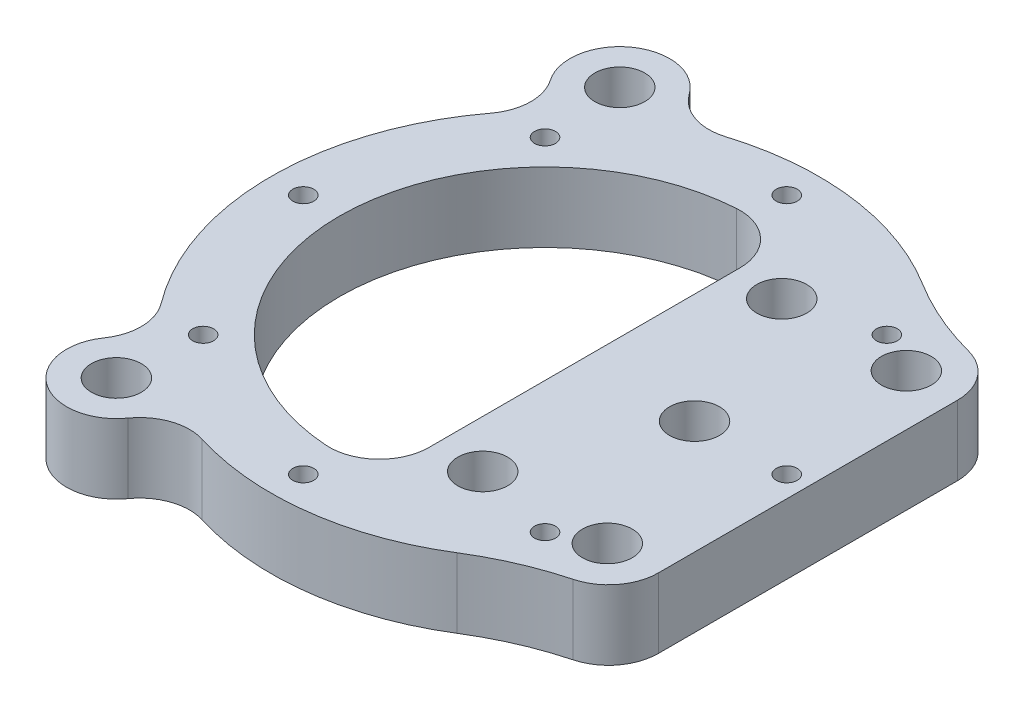
from build123d import *

# Parameters (mm, degrees)
BOSS_EXTRUDE1_DEPTH                                 = 14
FILLET1_R                                           = 10
FILLET2_R                                           = 60
SKETCH2_R                                           = 2.1
SKETCH2_R_2                                         = 3.062888277
CUT_EXTRUDE1_DEPTH                                  = 175.237067632
SKETCH3_R                                           = 2.5
CUT_EXTRUDE2_DEPTH                                  = 10
CBORE_FOR_M5_HEX_SOCKET_HEAD_CAP_SCREW1_D           = 5.5
CBORE_FOR_M5_HEX_SOCKET_HEAD_CAP_SCREW1_DEPTH       = 25
CBORE_FOR_M5_HEX_SOCKET_HEAD_CAP_SCREW1_CBORE_D     = 10
CBORE_FOR_M5_HEX_SOCKET_HEAD_CAP_SCREW1_CBORE_DEPTH = 8
CBORE_FOR_M5_HEX_SOCKET_HEAD_CAP_SCREW1_TIP         = 1.652366702
CUT_EXTRUDE3_DEPTH                                  = 25
FILLET3_R                                           = 10
CBORE_FOR_M5_HEX_SOCKET_HEAD_CAP_SCREW2_D           = 5.5
CBORE_FOR_M5_HEX_SOCKET_HEAD_CAP_SCREW2_DEPTH       = 25
CBORE_FOR_M5_HEX_SOCKET_HEAD_CAP_SCREW2_CBORE_D     = 10
CBORE_FOR_M5_HEX_SOCKET_HEAD_CAP_SCREW2_CBORE_DEPTH = 8
CBORE_FOR_M5_HEX_SOCKET_HEAD_CAP_SCREW2_TIP         = 1.652366702


with BuildPart() as part:
    # Sketch1 → Boss-Extrude1 (new body)
    with BuildSketch(Plane(origin=(0, 0, 0), x_dir=(1, 0, 0), z_dir=(0, 1, 0))):
        with BuildLine():
            Line((-68.874820235, 36.937111723), (-53.874820235, 36.937111723))
            Line((-53.874820235, 36.937111723), (-53.874820235, -43.062888277))
            Line((-53.874820235, -43.062888277), (-68.874820235, -43.062888277))
            ThreePointArc((-68.874820235, -43.062888277), (-97.683039558, -57.331289415), (-129.545963567, -53.058720487))
            Line((-129.545963567, -53.058720487), (-133.943104784, -59.313808797))
            ThreePointArc((-133.943104784, -59.313808797), (-147.874912369, -61.743775343), (-150.304878915, -47.811967758))
            Line((-150.304878915, -47.811967758), (-145.907737698, -41.556879448))
            ThreePointArc((-145.907737698, -41.556879448), (-161.623992411, -3.062888277), (-145.907737698, 35.431102894))
            Line((-145.907737698, 35.431102894), (-150.304878915, 41.686191203))
            ThreePointArc((-150.304878915, 41.686191203), (-147.874912369, 55.617998788), (-133.943104784, 53.188032242))
            Line((-133.943104784, 53.188032242), (-129.545963567, 46.932943933))
            ThreePointArc((-129.545963567, 46.932943933), (-97.683039558, 51.205512861), (-68.874820235, 36.937111723))
        make_face()
    extrude(amount=BOSS_EXTRUDE1_DEPTH)

    # Fillet1
    fillet1_edges = [part.edges().sort_by_distance(p)[0] for p in [
        (-53.874820235, 7, 43.062888277),
        (-129.545963567, 7, 53.058720487),
        (-145.907737698, 7, 41.556879448),
        (-129.545963567, 7, -46.932943933),
        (-53.874820235, 7, -36.937111723),
        (-145.907737698, 7, -35.431102894),
    ]]
    fillet(fillet1_edges, radius=FILLET1_R)

    # Fillet2
    fillet2_edges = [part.edges().sort_by_distance(p)[0] for p in [
        (-68.874820235, 7, 43.062888277),
        (-68.874820235, 7, -36.937111723),
    ]]
    fillet(fillet2_edges, radius=FILLET2_R)

    # Sketch2 → Cut-Extrude1 (cut, through all)
    with BuildSketch(Plane(origin=(0, 14, 0), x_dir=(1, 0, 0), z_dir=(0, 1, 0))):
        with Locations(Location((-106.623992411, 45.437111723, 0), (0, 0, 270))):
            Circle(SKETCH2_R)
        with Locations(Location((-72.329313524, 31.23179061, 0), (0, 0, 270))):
            Circle(SKETCH2_R)
        with Locations(Location((-58.123992411, -3.062888277, 0), (0, 0, 270))):
            Circle(SKETCH2_R)
        with Locations(Location((-72.329313524, -37.357567165, 0), (0, 0, 270))):
            Circle(SKETCH2_R)
        with Locations(Location((-106.623992411, -51.562888277, 0), (0, 0, 270))):
            Circle(SKETCH2_R)
        with Locations(Location((-140.918671299, -37.357567165, 0), (0, 0, 270))):
            Circle(SKETCH2_R)
        with Locations(Location((-155.123992411, -3.062888277, 0), (0, 0, 270))):
            Circle(SKETCH2_R)
        with Locations(Location((-140.918671299, 31.23179061, 0), (0, 0, 270))):
            Circle(SKETCH2_R)
        with Locations(Location((-106.623992411, -3.062888277, 0), (0, 0, 270))):
            Circle(SKETCH2_R_2)
    extrude(amount=-CUT_EXTRUDE1_DEPTH, mode=Mode.SUBTRACT)

    # Sketch3 → Cut-Extrude2 (cut)
    with BuildSketch(Plane(origin=(0, 14, 0), x_dir=(1, 0, 0), z_dir=(0, 1, 0))):
        with Locations(Location((-142.12399185, 47.437111723, 0), (0, 0, 270))):
            Circle(SKETCH3_R)
        with Locations(Location((-142.12399185, -53.562888277, 0), (0, 0, 270))):
            Circle(SKETCH3_R)
    extrude(amount=-CUT_EXTRUDE2_DEPTH, mode=Mode.SUBTRACT)

    # CBORE for M5 Hex Socket Head Cap Screw1
    with Locations(Plane(origin=(0, 14, 0), x_dir=(1, 0, 0), z_dir=(0, 1, 0))):
        with Locations((-89.123992411, 26.937111723), (-64.123992411, 26.937111723), (-76.623992411, -3.062888277), (-89.123992411, -33.062888277), (-64.123992411, -33.062888277)):
            CounterBoreHole(CBORE_FOR_M5_HEX_SOCKET_HEAD_CAP_SCREW1_D / 2, CBORE_FOR_M5_HEX_SOCKET_HEAD_CAP_SCREW1_CBORE_D / 2, CBORE_FOR_M5_HEX_SOCKET_HEAD_CAP_SCREW1_CBORE_DEPTH, depth=CBORE_FOR_M5_HEX_SOCKET_HEAD_CAP_SCREW1_DEPTH)
            with Locations((0, 0, -(CBORE_FOR_M5_HEX_SOCKET_HEAD_CAP_SCREW1_DEPTH + CBORE_FOR_M5_HEX_SOCKET_HEAD_CAP_SCREW1_TIP / 2))):  # 118° drill point
                Cone(0, CBORE_FOR_M5_HEX_SOCKET_HEAD_CAP_SCREW1_D / 2, CBORE_FOR_M5_HEX_SOCKET_HEAD_CAP_SCREW1_TIP, mode=Mode.SUBTRACT)

    # Sketch7 → Cut-Extrude3 (cut)
    with BuildSketch(Plane(origin=(0, 14, 0), x_dir=(1, 0, 0), z_dir=(0, 1, 0))):
        with BuildLine():
            Line((-98.692393489, -43.543158021), (-98.692393489, 37.417381467))
            ThreePointArc((-98.692393489, 37.417381467), (-147.873992411, -3.062888277), (-98.692393489, -43.543158021))
        make_face()
    extrude(amount=-CUT_EXTRUDE3_DEPTH, mode=Mode.SUBTRACT)

    # Fillet3
    fillet3_edges = [part.edges().sort_by_distance(p)[0] for p in [
        (-98.692393489, 7, 43.543158021),
        (-98.692393489, 7, -37.417381467),
    ]]
    fillet(fillet3_edges, radius=FILLET3_R)

    # CBORE for M5 Hex Socket Head Cap Screw2
    with Locations(Plane(origin=(0, 14, 0), x_dir=(1, 0, 0), z_dir=(0, 1, 0))):
        with Locations((-142.12399185, 47.437111723), (-142.12399185, -53.562888277)):
            CounterBoreHole(CBORE_FOR_M5_HEX_SOCKET_HEAD_CAP_SCREW2_D / 2, CBORE_FOR_M5_HEX_SOCKET_HEAD_CAP_SCREW2_CBORE_D / 2, CBORE_FOR_M5_HEX_SOCKET_HEAD_CAP_SCREW2_CBORE_DEPTH, depth=CBORE_FOR_M5_HEX_SOCKET_HEAD_CAP_SCREW2_DEPTH)
            with Locations((0, 0, -(CBORE_FOR_M5_HEX_SOCKET_HEAD_CAP_SCREW2_DEPTH + CBORE_FOR_M5_HEX_SOCKET_HEAD_CAP_SCREW2_TIP / 2))):  # 118° drill point
                Cone(0, CBORE_FOR_M5_HEX_SOCKET_HEAD_CAP_SCREW2_D / 2, CBORE_FOR_M5_HEX_SOCKET_HEAD_CAP_SCREW2_TIP, mode=Mode.SUBTRACT)


solid = part.part
